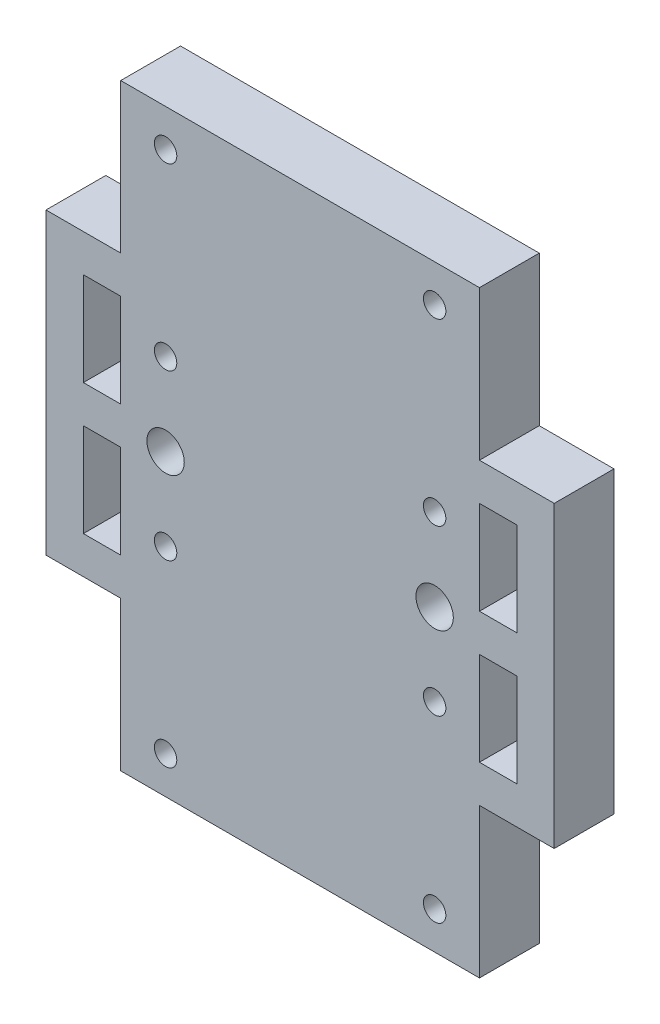
from build123d import *

# Parameters (mm, degrees)
SKETCH_1_W          = 5
SKETCH_1_H          = 12.5
SKETCH_1_R          = 1.5
EXTRUDE_1_DEPTH     = 8
SKETCH_2_R          = 2.5
CUT_EXTRUDE_1_DEPTH = 10


with BuildPart() as part:
    # 草图1 → 凸台-拉伸1 (new body)
    with BuildSketch(Plane.XY):
        Polygon((2.0625, 31.40625), (-45.9375, 31.40625), (-45.9375, 11.40625), (-55.9375, 11.40625), (-55.9375, -28.59375), (-45.9375, -28.59375), (-45.9375, -48.59375), (2.0625, -48.59375), (2.0625, -28.59375), (12.0625, -28.59375), (12.0625, 11.40625), (2.0625, 11.40625), align=None)
        with Locations((4.5625, 0.15625)):
            Rectangle(SKETCH_1_W, SKETCH_1_H, mode=Mode.SUBTRACT)
        with Locations((4.5625, -17.34375)):
            Rectangle(SKETCH_1_W, SKETCH_1_H, mode=Mode.SUBTRACT)
        with Locations((-39.9375, -43.59375)):
            Circle(SKETCH_1_R, mode=Mode.SUBTRACT)
        with Locations((-39.9375, -19.59375)):
            Circle(SKETCH_1_R, mode=Mode.SUBTRACT)
        with Locations((-48.4375, -17.34375)):
            Rectangle(SKETCH_1_W, SKETCH_1_H, mode=Mode.SUBTRACT)
        with Locations((-3.9375, -43.59375)):
            Circle(SKETCH_1_R, mode=Mode.SUBTRACT)
        with Locations((-3.9375, -19.59375)):
            Circle(SKETCH_1_R, mode=Mode.SUBTRACT)
        with Locations((-48.4375, 0.15625)):
            Rectangle(SKETCH_1_W, SKETCH_1_H, mode=Mode.SUBTRACT)
        with Locations((-39.9375, 2.40625)):
            Circle(SKETCH_1_R, mode=Mode.SUBTRACT)
        with Locations((-39.9375, 26.40625)):
            Circle(SKETCH_1_R, mode=Mode.SUBTRACT)
        with Locations((-3.9375, 2.40625)):
            Circle(SKETCH_1_R, mode=Mode.SUBTRACT)
        with Locations((-3.9375, 26.40625)):
            Circle(SKETCH_1_R, mode=Mode.SUBTRACT)
    extrude(amount=EXTRUDE_1_DEPTH)

    # 草图2 → 切除-拉伸1 (cut)
    with BuildSketch(Plane.XY.offset(8)):
        with Locations((-39.9375, -8.59375)):
            Circle(SKETCH_2_R)
        with Locations((-3.9375, -8.59375)):
            Circle(SKETCH_2_R)
    extrude(amount=-CUT_EXTRUDE_1_DEPTH, mode=Mode.SUBTRACT)


solid = part.part
